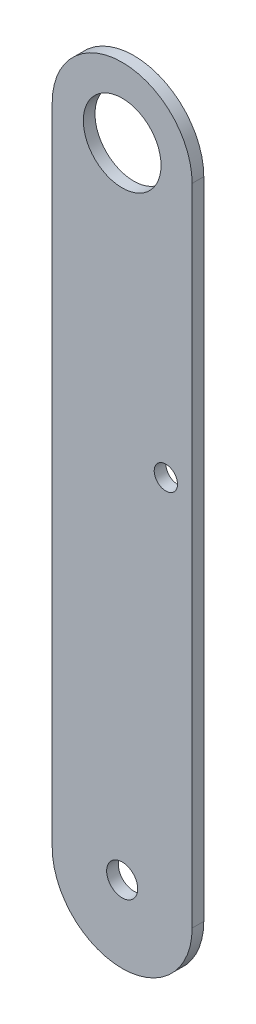
from build123d import *

# Parameters (mm, degrees)
BOSS_EXTRUDE1_DEPTH = 1.5
SKETCH2_R           = 5
SKETCH2_R_2         = 1.5
SKETCH2_R_3         = 2
CUT_EXTRUDE1_DEPTH  = 1.5


with BuildPart() as part:
    # Sketch1 → Boss-Extrude1 (new body)
    with BuildSketch(Plane.XY):
        with BuildLine():
            Line((-15.542553191, 34.468085106), (-15.542553191, -48.510638298))
            ThreePointArc((-15.542553191, -48.510638298), (-6.542553191, -57.510638298), (2.457446809, -48.510638298))
            Line((2.457446809, -48.510638298), (2.457446809, 34.468085106))
            ThreePointArc((2.457446809, 34.468085106), (-6.542553191, 43.468085106), (-15.542553191, 34.468085106))
        make_face()
    extrude(amount=BOSS_EXTRUDE1_DEPTH)

    # Sketch2 → Cut-Extrude1 (cut)
    with BuildSketch(Plane.XY.offset(1.5)):
        with Locations((-6.542553191, 34.468085106)):
            Circle(SKETCH2_R)
        with Locations((-0.919972029, 0)):
            Circle(SKETCH2_R_2)
        with Locations((-6.542553191, -47.642022548)):
            Circle(SKETCH2_R_3)
    extrude(amount=-CUT_EXTRUDE1_DEPTH, mode=Mode.SUBTRACT)


solid = part.part
